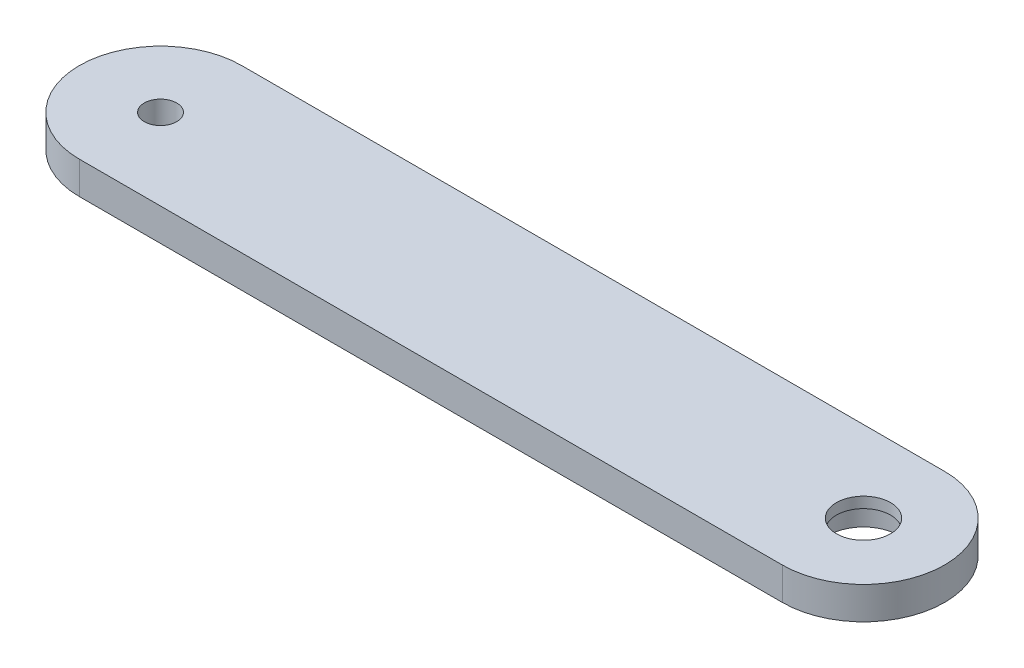
from build123d import *

# Parameters (mm, degrees)
SKETCH2_R           = 3
SKETCH2_R_2         = 5
BOSS_EXTRUDE1_DEPTH = 6
SKETCH4_R           = 6.5
CUT_EXTRUDE1_DEPTH  = 4


with BuildPart() as part:
    # Sketch2 → Boss-Extrude1 (new body)
    with BuildSketch(Plane(origin=(0, 0, 0), x_dir=(1, 0, 0), z_dir=(0, 1, 0))):
        with BuildLine():
            Line((-6.5, 28.5), (123.5, 28.5))
            ThreePointArc((123.5, 28.5), (138.5, 13.5), (123.5, -1.5))
            Line((123.5, -1.5), (-6.5, -1.5))
            ThreePointArc((-6.5, -1.5), (-21.5, 13.5), (-6.5, 28.5))
        make_face()
        with Locations(Location((-6.5, 13.5, 0), (0, 0, 270))):
            Circle(SKETCH2_R, mode=Mode.SUBTRACT)
        with Locations(Location((123.5, 13.5, 0), (0, 0, 270))):
            Circle(SKETCH2_R_2, mode=Mode.SUBTRACT)
    extrude(amount=BOSS_EXTRUDE1_DEPTH)

    # Sketch4 → Cut-Extrude1 (cut)
    with BuildSketch(Plane.XZ):
        with Locations(Location((123.5, -13.5, 0), (0, 0, 270))):
            Circle(SKETCH4_R)
    extrude(amount=-CUT_EXTRUDE1_DEPTH, mode=Mode.SUBTRACT)


solid = part.part
